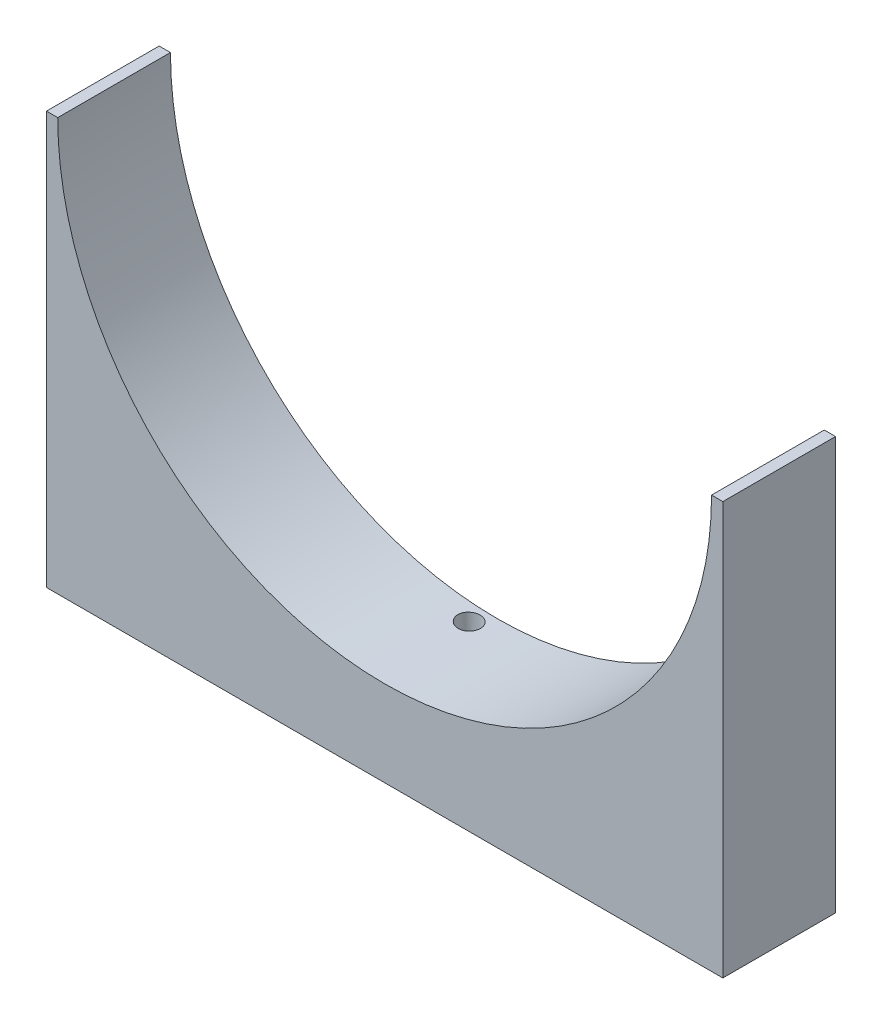
from build123d import *

# Parameters (mm, degrees)
BOSS_EXTRUDE1_DEPTH = 12.7
SKETCH2_W           = 3.556
SKETCH2_H           = 3.556
BOSS_EXTRUDE2_DEPTH = 2.54
SKETCH3_R           = 1.27
CUT_EXTRUDE1_DEPTH  = 14.986


with BuildPart() as part:
    # Sketch1 → Boss-Extrude1 (new body)
    with BuildSketch(Plane.XY):
        with BuildLine():
            Line((-38.1, 23.241), (-38.1, -23.241))
            Line((-38.1, -23.241), (38.1, -23.241))
            Line((38.1, -23.241), (38.1, 23.241))
            Line((38.1, 23.241), (36.83, 23.241))
            ThreePointArc((36.83, 23.241), (0, -13.589), (-36.83, 23.241))
            Line((-36.83, 23.241), (-38.1, 23.241))
        make_face()
    extrude(amount=BOSS_EXTRUDE1_DEPTH)

    # Sketch2 → Boss-Extrude2 (add)
    with BuildSketch(Plane.XZ.offset(23.241)):
        with Locations((11.43, 1.905)):
            Rectangle(SKETCH2_W, SKETCH2_H)
        with Locations((-13.97, 1.905)):
            Rectangle(SKETCH2_W, SKETCH2_H)
    extrude(amount=BOSS_EXTRUDE2_DEPTH)

    # Sketch3 → Cut-Extrude1 (cut)
    with BuildSketch(Plane(origin=(0, -23.241, 0), x_dir=(-1, 0, 0), z_dir=(0, -1, 0))):
        with Locations((1.27, -1.905)):
            Circle(SKETCH3_R)
    extrude(amount=-CUT_EXTRUDE1_DEPTH, mode=Mode.SUBTRACT)


solid = part.part
